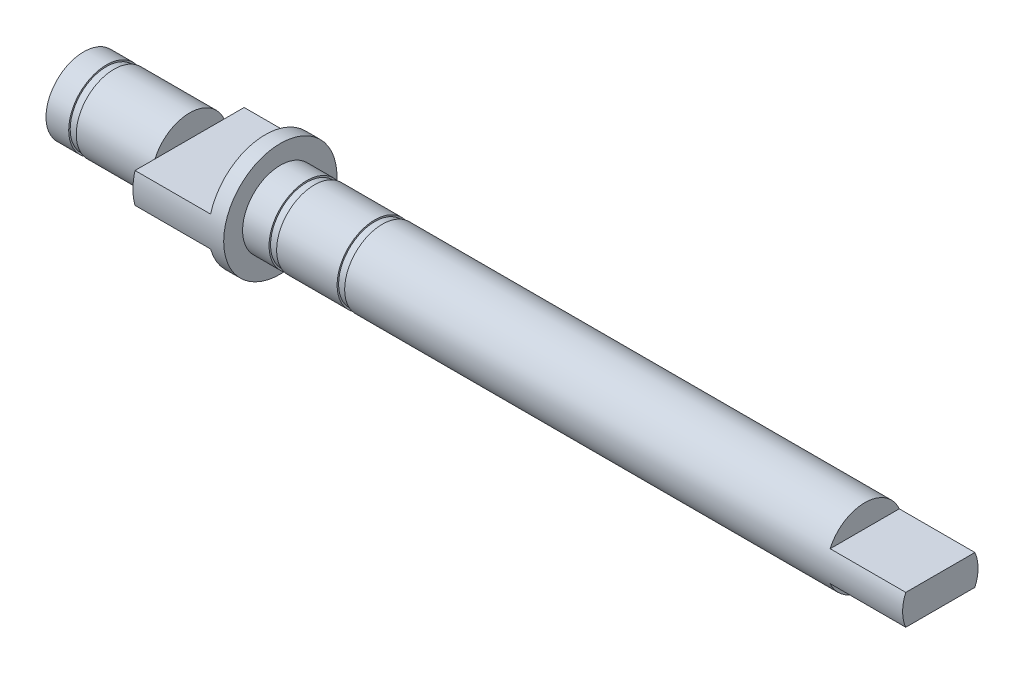
from build123d import *

# Parameters (mm, degrees)
CUT_EXTRUDE8_DEPTH = 10
CUT_EXTRUDE9_DEPTH = 10


with BuildPart() as part:
    # Sketch3 → Revolve1 (revolve)
    with BuildSketch(Plane(origin=(0, 0, 0), x_dir=(1, 0, 0), z_dir=(0, 1, 0)), mode=Mode.PRIVATE) as revolve1_sk:
        Polygon((0, 0), (113.3, 0), (113.3, 4.99), (39.5, 4.99), (39.5, 4.79), (38.5, 4.79), (38.5, 4.99), (30.5, 4.99), (30.5, 4.79), (29.5, 4.79), (29.5, 4.99), (26, 4.99), (26, 7.49), (14, 7.49), (14, 4.99), (4, 4.99), (4, 4.79), (3, 4.79), (3, 4.99), (0, 4.99), align=None)
    revolve(revolve1_sk.sketch.rotate(Axis((0, 0, 0), (1, 0, 0)), 180), axis=Axis((0, 0, 0), (1, 0, 0)))

    # Sketch10 → Cut-Extrude8 (cut)
    with BuildSketch(Plane.ZY.offset(-14)):
        with BuildLine():
            Line((7.228416147, 2), (-7.228416147, 2))
            ThreePointArc((-7.228416147, 2), (0, 7.5), (7.228416147, 2))
        make_face()
        with BuildLine():
            Line((7.228416147, -2), (-7.228416147, -2))
            ThreePointArc((-7.228416147, -2), (0, -7.5), (7.228416147, -2))
        make_face()
    extrude(amount=-CUT_EXTRUDE8_DEPTH, mode=Mode.SUBTRACT)

    # Sketch11 → Cut-Extrude9 (cut)
    with BuildSketch(Plane(origin=(113.3, 0, 0), x_dir=(0, 0, -1), z_dir=(1, 0, 0))):
        with BuildLine():
            Line((-4.582575695, -2), (4.582575695, -2))
            ThreePointArc((4.582575695, -2), (0, -5), (-4.582575695, -2))
        make_face()
        with BuildLine():
            Line((4.582575695, 2), (-4.582575695, 2))
            ThreePointArc((-4.582575695, 2), (0, 5), (4.582575695, 2))
        make_face()
    extrude(amount=-CUT_EXTRUDE9_DEPTH, mode=Mode.SUBTRACT)


solid = part.part
